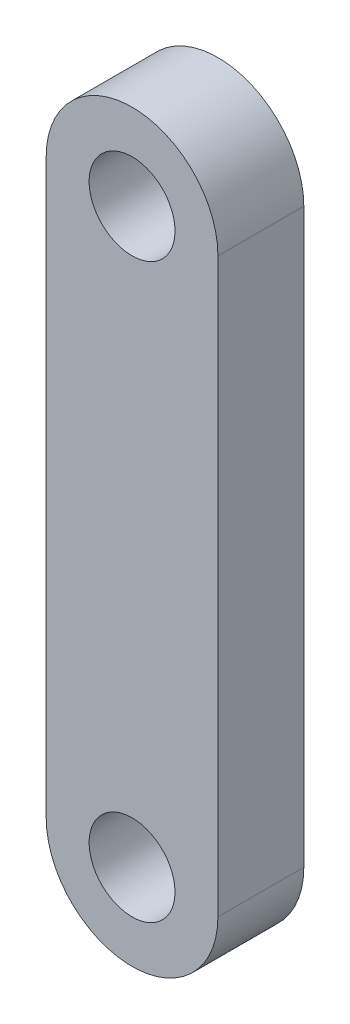
from build123d import *

# Parameters (mm, degrees)
SKETCH2_R           = 3
BOSS_EXTRUDE1_DEPTH = 6
SCALE1_SCALE        = 0.5


with BuildPart() as part:
    # Sketch2 → Boss-Extrude1 (new body)
    with BuildSketch(Plane.XY):
        with BuildLine():
            Line((6, 20), (6, -20))
            ThreePointArc((6, -20), (0, -26), (-6, -20))
            Line((-6, -20), (-6, 20))
            ThreePointArc((-6, 20), (0, 26), (6, 20))
        make_face()
        with Locations((0, 20)):
            Circle(SKETCH2_R, mode=Mode.SUBTRACT)
        with Locations((0, -20)):
            Circle(SKETCH2_R, mode=Mode.SUBTRACT)
    extrude(amount=-BOSS_EXTRUDE1_DEPTH)


with BuildPart() as part_1:
    # Scale1: scaled about (0, 0, -3)
    add(part.part.scale(SCALE1_SCALE).moved(Location((0, 0, -1.5))))


solid = part_1.part
